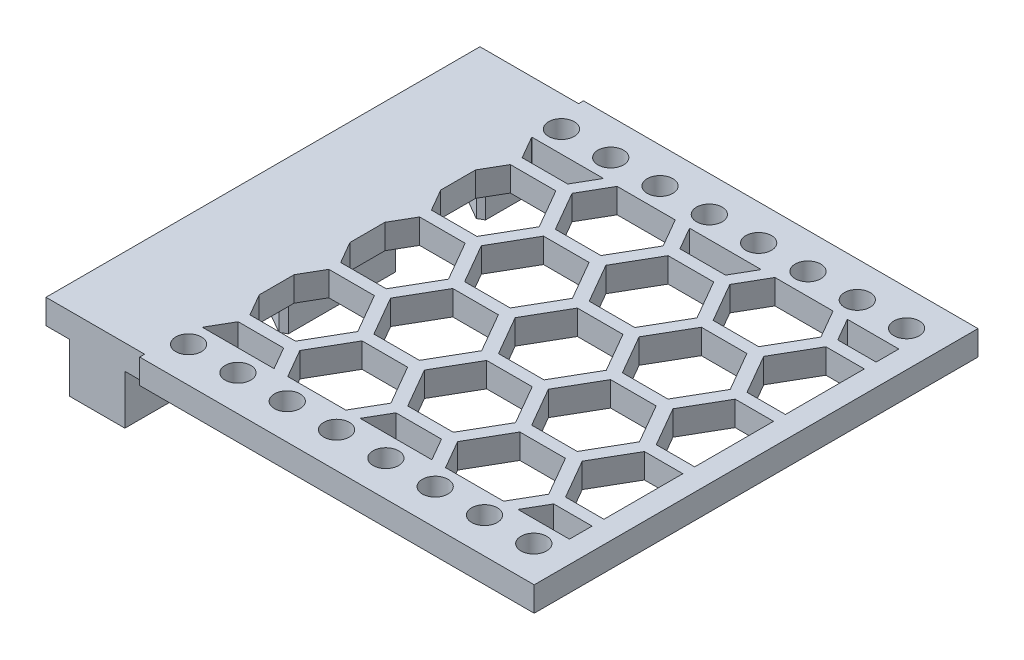
from build123d import *

# Parameters (mm, degrees)
SKETCH1_W           = 50.8
SKETCH1_H           = 57.15
SKETCH1_W_2         = 2.54
SKETCH1_H_2         = 55.88
SKETCH1_W_3         = 10.16
BOSS_EXTRUDE1_DEPTH = 3.175
BOSS_EXTRUDE2_DEPTH = 6.35
SKETCH3_R           = 1.651
CUT_EXTRUDE1_DEPTH  = 49.568160867
CUT_EXTRUDE2_DEPTH  = 49.568160867


with BuildPart() as part:
    # Sketch1 → Boss-Extrude1 (new body)
    with BuildSketch(Plane(origin=(0, 0, 0), x_dir=(1, 0, 0), z_dir=(0, 1, 0))):
        Rectangle(SKETCH1_W, SKETCH1_H)
        with Locations((-26.67, 0)):
            Rectangle(SKETCH1_W_2, SKETCH1_H_2)
        with Locations((-33.02, 0)):
            Rectangle(SKETCH1_W_3, SKETCH1_H_2)
    extrude(amount=BOSS_EXTRUDE1_DEPTH)

    # Sketch2 → Boss-Extrude2 (add)
    with BuildSketch(Plane.XZ):
        Polygon((-27.94, 6.892407514), (-28.702, 7.332348419), (-35.052, 3.666174209), (-35.052, -3.666174209), (-28.702, -7.332348419), (-27.94, -6.892407514), align=None)
        Polygon((-35.052, 27.94), (-35.052, 21.733825791), (-28.702, 18.067651581), (-27.94, 18.507592486), (-27.94, 27.94), align=None)
        Polygon((-27.94, -18.507592486), (-27.94, -27.94), (-35.052, -27.94), (-35.052, -21.733825791), (-28.702, -18.067651581), align=None)
    extrude(amount=BOSS_EXTRUDE2_DEPTH)

    # Sketch3 → Cut-Extrude1 (cut, through all)
    with BuildSketch(Plane(origin=(0, 3.175, 0), x_dir=(1, 0, 0), z_dir=(0, 1, 0))):
        with Locations(Location((20.7772, -24.003, 0), (0, 0, 270))):
            Circle(SKETCH3_R)
        with Locations(Location((14.4272, -24.003, 0), (0, 0, 270))):
            Circle(SKETCH3_R)
        with Locations(Location((8.0772, -24.003, 0), (0, 0, 270))):
            Circle(SKETCH3_R)
        with Locations(Location((1.7272, -24.003, 0), (0, 0, 270))):
            Circle(SKETCH3_R)
        with Locations(Location((-4.6228, -24.003, 0), (0, 0, 270))):
            Circle(SKETCH3_R)
        with Locations(Location((-10.9728, -24.003, 0), (0, 0, 270))):
            Circle(SKETCH3_R)
        with Locations(Location((-17.3228, -24.003, 0), (0, 0, 270))):
            Circle(SKETCH3_R)
        with Locations(Location((-23.6728, -24.003, 0), (0, 0, 270))):
            Circle(SKETCH3_R)
        with Locations(Location((-23.6728, 24.003, 0), (0, 0, 270))):
            Circle(SKETCH3_R)
        with Locations(Location((-17.3228, 24.003, 0), (0, 0, 270))):
            Circle(SKETCH3_R)
        with Locations(Location((-10.9728, 24.003, 0), (0, 0, 270))):
            Circle(SKETCH3_R)
        with Locations(Location((-4.6228, 24.003, 0), (0, 0, 270))):
            Circle(SKETCH3_R)
        with Locations(Location((1.7272, 24.003, 0), (0, 0, 270))):
            Circle(SKETCH3_R)
        with Locations(Location((8.0772, 24.003, 0), (0, 0, 270))):
            Circle(SKETCH3_R)
        with Locations(Location((14.4272, 24.003, 0), (0, 0, 270))):
            Circle(SKETCH3_R)
        with Locations(Location((20.7772, 24.003, 0), (0, 0, 270))):
            Circle(SKETCH3_R)
    extrude(amount=-CUT_EXTRUDE1_DEPTH, mode=Mode.SUBTRACT)

    # Sketch4 → Cut-Extrude2 (cut, through all)
    with BuildSketch(Plane(origin=(0, 3.175, 0), x_dir=(1, 0, 0), z_dir=(0, 1, 0))):
        Polygon((17.634991976, 18.279152345), (22.579981612, 18.279152345), (22.579981612, 21.200152345), (15.94855184, 21.200152345), align=None)
        Polygon((16.232450896, 17.517152345), (14.106069855, 21.200152345), (6.627074468, 21.200152345), (4.500693426, 17.517152345), (7.433632794, 12.437152345), (13.299511529, 12.437152345), align=None)
        Polygon((3.180870711, 18.279152345), (4.867310847, 21.200152345), (-4.37144816, 21.200152345), (-2.685008024, 18.279152345), align=None)
        Polygon((-4.087549104, 17.517152345), (-6.213930145, 21.200152345), (-13.692925532, 21.200152345), (-15.819306574, 17.517152345), (-12.886367206, 12.437152345), (-7.020488471, 12.437152345), align=None)
        Polygon((-17.139129289, 18.279152345), (-15.452689153, 21.200152345), (-24.641954227, 21.200152345), (-24.641954227, 21.114426338), (-23.005008024, 18.279152345), align=None)
        Polygon((-23.005008024, 16.755152345), (-24.641954227, 13.919878353), (-24.641954227, 9.430426338), (-23.005008024, 6.595152345), (-17.139129289, 6.595152345), (-14.206189922, 11.675152345), (-17.139129289, 16.755152345), align=None)
        Polygon((-23.005008024, 5.071152345), (-24.641954227, 2.235878353), (-24.641954227, -2.253573662), (-23.005008024, -5.088847655), (-17.139129289, -5.088847655), (-14.206189922, -0.008847655), (-17.139129289, 5.071152345), align=None)
        Polygon((-24.641954227, -9.448121647), (-24.641954227, -13.937573662), (-23.005008024, -16.772847655), (-17.139129289, -16.772847655), (-14.206189922, -11.692847655), (-17.139129289, -6.612847655), (-23.005008024, -6.612847655), align=None)
        Polygon((-24.641954227, -21.217847655), (-15.452689153, -21.217847655), (-17.139129289, -18.296847655), (-23.005008024, -18.296847655), (-24.641954227, -21.132121647), align=None)
        Polygon((-13.692925532, -21.217847655), (-6.213930145, -21.217847655), (-4.087549104, -17.534847655), (-7.020488471, -12.454847655), (-12.886367206, -12.454847655), (-15.819306574, -17.534847655), align=None)
        Polygon((-4.37144816, -21.217847655), (4.867310847, -21.217847655), (3.180870711, -18.296847655), (-2.685008024, -18.296847655), align=None)
        Polygon((6.627074468, -21.217847655), (14.106069855, -21.217847655), (16.232450896, -17.534847655), (13.299511529, -12.454847655), (7.433632794, -12.454847655), (4.500693426, -17.534847655), align=None)
        Polygon((22.579981612, -21.217847655), (22.579981612, -18.296847655), (17.634991976, -18.296847655), (15.94855184, -21.217847655), align=None)
        Polygon((22.579981612, -16.772847655), (22.579981612, -6.612847655), (17.634991976, -6.612847655), (14.702052608, -11.692847655), (17.634991976, -16.772847655), align=None)
        Polygon((22.579981612, -5.088847655), (22.579981612, 5.071152345), (17.634991976, 5.071152345), (14.702052608, -0.008847655), (17.634991976, -5.088847655), align=None)
        Polygon((17.634991976, 6.595152345), (22.579981612, 6.595152345), (22.579981612, 16.755152345), (17.634991976, 16.755152345), (14.702052608, 11.675152345), align=None)
        Polygon((4.500693426, 5.833152345), (7.433632794, 0.753152345), (13.299511529, 0.753152345), (16.232450896, 5.833152345), (13.299511529, 10.913152345), (7.433632794, 10.913152345), align=None)
        Polygon((-2.685008024, 6.595152345), (3.180870711, 6.595152345), (6.113810078, 11.675152345), (3.180870711, 16.755152345), (-2.685008024, 16.755152345), (-5.617947392, 11.675152345), align=None)
        Polygon((-2.685008024, -5.088847655), (3.180870711, -5.088847655), (6.113810078, -0.008847655), (3.180870711, 5.071152345), (-2.685008024, 5.071152345), (-5.617947392, -0.008847655), align=None)
        Polygon((4.500693426, -5.850847655), (7.433632794, -10.930847655), (13.299511529, -10.930847655), (16.232450896, -5.850847655), (13.299511529, -0.770847655), (7.433632794, -0.770847655), align=None)
        Polygon((-2.685008024, -16.772847655), (3.180870711, -16.772847655), (6.113810078, -11.692847655), (3.180870711, -6.612847655), (-2.685008024, -6.612847655), (-5.617947392, -11.692847655), align=None)
        Polygon((-15.819306574, -5.850847655), (-12.886367206, -10.930847655), (-7.020488471, -10.930847655), (-4.087549104, -5.850847655), (-7.020488471, -0.770847655), (-12.886367206, -0.770847655), align=None)
        Polygon((-15.819306574, 5.833152345), (-12.886367206, 0.753152345), (-7.020488471, 0.753152345), (-4.087549104, 5.833152345), (-7.020488471, 10.913152345), (-12.886367206, 10.913152345), align=None)
    extrude(amount=-CUT_EXTRUDE2_DEPTH, mode=Mode.SUBTRACT)


solid = part.part
